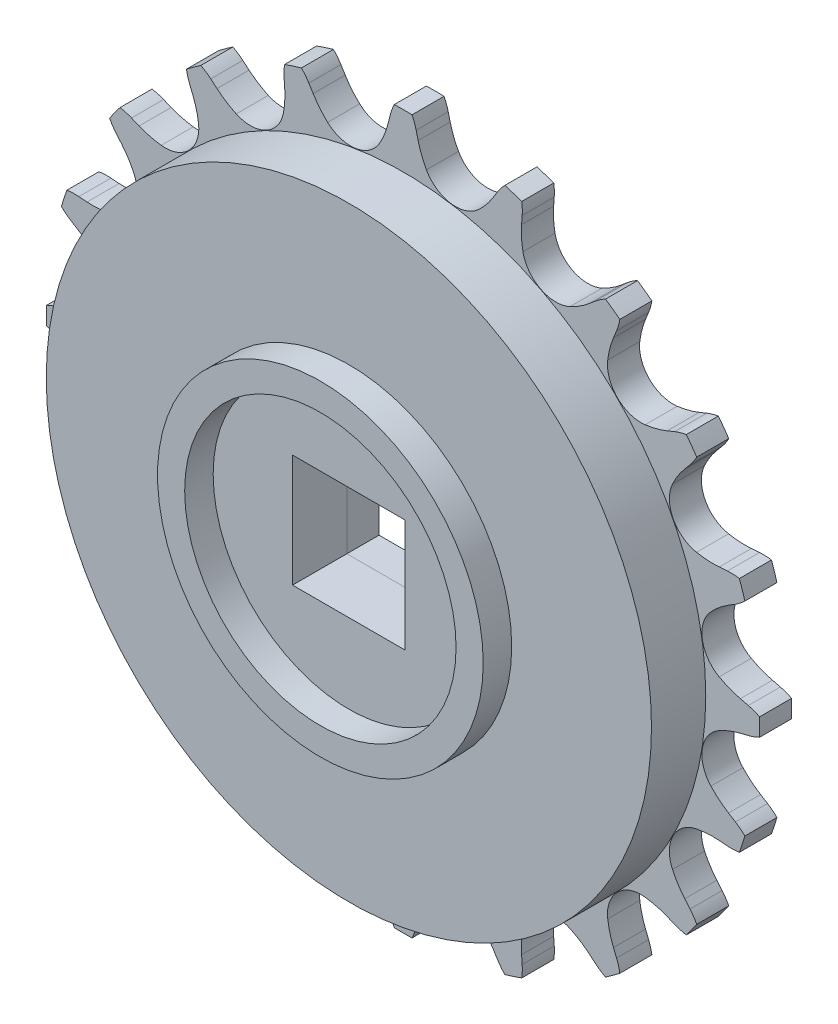
from build123d import *

# Parameters (mm, degrees)
SKETCH1_R           = 6.787119857
BOSS_EXTRUDE1_DEPTH = 2.3622
SKETCH2_R           = 18
BOSS_EXTRUDE2_DEPTH = 2.4
SKETCH6_R           = 22.300536673
BOSS_EXTRUDE3_DEPTH = 4
SKETCH8_W           = 8.3
SKETCH8_H           = 8.3
CUT_EXTRUDE1_DEPTH  = 38.706770721
SKETCH16_W          = 10
SKETCH16_H          = 8.25
BOSS_EXTRUDE6_DEPTH = 9.74160395
SKETCH17_R          = 12
SKETCH17_R_2        = 10
EXTRUDE_THIN1_DEPTH = 2.1
SKETCH18_R          = 53.221280842
CUT_EXTRUDE4_DEPTH  = 9


with BuildPart() as part:
    # Sketch1 → Boss-Extrude1 (new body)
    with BuildSketch(Plane.XY.offset(0.25)):
        with BuildLine():
            Line((-24.488227524, 6.948596415), (-23.976513369, 6.631320197))
            ThreePointArc((-23.976513369, 6.631320197), (-23.291994454, 6.141252786), (-22.678303214, 5.564958353))
            ThreePointArc((-22.678303214, 5.564958353), (-22.044379306, 3.491486679), (-23.288014754, 1.715391192))
            ThreePointArc((-23.288014754, 1.715391192), (-24.04975458, 1.356943638), (-24.852209913, 1.102389812))
            Line((-24.852209913, 1.102389812), (-25.436922738, 0.958770568))
            ThreePointArc((-25.436922738, 0.958770568), (-25.860833079, 0.829247508), (-26.267723996, 0.653418098))
            ThreePointArc((-26.267723996, 0.653418098), (-26.275849732, 0), (-26.267723996, -0.653418098))
            ThreePointArc((-26.267723996, -0.653418098), (-25.860833079, -0.829247508), (-25.436922738, -0.958770568))
            Line((-25.436922738, -0.958770568), (-24.852209913, -1.102389812))
            ThreePointArc((-24.852209913, -1.102389812), (-24.04975458, -1.356943638), (-23.288014754, -1.715391192))
            ThreePointArc((-23.288014754, -1.715391192), (-22.044379306, -3.491486679), (-22.678303214, -5.564958353))
            ThreePointArc((-22.678303214, -5.564958353), (-23.291994454, -6.141252786), (-23.976513369, -6.631320197))
            Line((-23.976513369, -6.631320197), (-24.488227524, -6.948596415))
            ThreePointArc((-24.488227524, -6.948596415), (-24.851365389, -7.202775664), (-25.184007371, -7.495735579))
            ThreePointArc((-25.184007371, -7.495735579), (-24.989818108, -8.119684109), (-24.780172778, -8.738610658))
            ThreePointArc((-24.780172778, -8.738610658), (-24.338862244, -8.780098157), (-23.895674726, -8.772286407))
            Line((-23.895674726, -8.772286407), (-23.295198996, -8.728190226))
            ThreePointArc((-23.295198996, -8.728190226), (-22.453357164, -8.722312965), (-21.618133153, -8.827826296))
            ThreePointArc((-21.618133153, -8.827826296), (-19.886521867, -10.132688993), (-19.848681346, -12.300571001))
            ThreePointArc((-19.848681346, -12.300571001), (-20.254251625, -13.0383006), (-20.753828642, -13.715910381))
            Line((-20.753828642, -13.715910381), (-21.14245398, -14.175786366))
            ThreePointArc((-21.14245398, -14.175786366), (-21.409272906, -14.529740969), (-21.635104637, -14.911154431))
            ThreePointArc((-21.635104637, -14.911154431), (-21.257608974, -15.444556964), (-20.866965595, -15.968407121))
            ThreePointArc((-20.866965595, -15.968407121), (-20.434433994, -15.871491623), (-20.01535158, -15.727109732))
            Line((-20.01535158, -15.727109732), (-19.457891694, -15.499614567))
            ThreePointArc((-19.457891694, -15.499614567), (-18.659068707, -15.233881527), (-17.832118057, -15.076132254))
            ThreePointArc((-17.832118057, -15.076132254), (-15.782033111, -15.782033111), (-15.076132254, -17.832118057))
            ThreePointArc((-15.076132254, -17.832118057), (-15.233881527, -18.659068707), (-15.499614567, -19.457891694))
            Line((-15.499614567, -19.457891694), (-15.727109732, -20.01535158))
            ThreePointArc((-15.727109732, -20.01535158), (-15.871491623, -20.434433994), (-15.968407121, -20.866965595))
            ThreePointArc((-15.968407121, -20.866965595), (-15.444556964, -21.257608974), (-14.911154431, -21.635104637))
            ThreePointArc((-14.911154431, -21.635104637), (-14.529740969, -21.409272906), (-14.175786366, -21.14245398))
            Line((-14.175786366, -21.14245398), (-13.715910381, -20.753828642))
            ThreePointArc((-13.715910381, -20.753828642), (-13.0383006, -20.254251625), (-12.300571001, -19.848681346))
            ThreePointArc((-12.300571001, -19.848681346), (-10.132688993, -19.886521867), (-8.827826296, -21.618133153))
            ThreePointArc((-8.827826296, -21.618133153), (-8.722312965, -22.453357164), (-8.728190226, -23.295198996))
            Line((-8.728190226, -23.295198996), (-8.772286407, -23.895674726))
            ThreePointArc((-8.772286407, -23.895674726), (-8.780098157, -24.338862244), (-8.738610658, -24.780172778))
            ThreePointArc((-8.738610658, -24.780172778), (-8.119684109, -24.989818108), (-7.495735579, -25.184007371))
            ThreePointArc((-7.495735579, -25.184007371), (-7.202775664, -24.851365389), (-6.948596415, -24.488227524))
            Line((-6.948596415, -24.488227524), (-6.631320197, -23.976513369))
            ThreePointArc((-6.631320197, -23.976513369), (-6.141252786, -23.291994454), (-5.564958353, -22.678303214))
            ThreePointArc((-5.564958353, -22.678303214), (-3.491486679, -22.044379306), (-1.715391192, -23.288014754))
            ThreePointArc((-1.715391192, -23.288014754), (-1.356943638, -24.04975458), (-1.102389812, -24.852209913))
            Line((-1.102389812, -24.852209913), (-0.958770568, -25.436922738))
            ThreePointArc((-0.958770568, -25.436922738), (-0.829247508, -25.860833079), (-0.653418098, -26.267723996))
            ThreePointArc((-0.653418098, -26.267723996), (0, -26.275849732), (0.653418098, -26.267723996))
            ThreePointArc((0.653418098, -26.267723996), (0.829247508, -25.860833079), (0.958770568, -25.436922738))
            Line((0.958770568, -25.436922738), (1.102389812, -24.852209913))
            ThreePointArc((1.102389812, -24.852209913), (1.356943638, -24.04975458), (1.715391192, -23.288014754))
            ThreePointArc((1.715391192, -23.288014754), (3.491486679, -22.044379306), (5.564958353, -22.678303214))
            ThreePointArc((5.564958353, -22.678303214), (6.141252786, -23.291994454), (6.631320197, -23.976513369))
            Line((6.631320197, -23.976513369), (6.948596415, -24.488227524))
            ThreePointArc((6.948596415, -24.488227524), (7.202775664, -24.851365389), (7.495735579, -25.184007371))
            ThreePointArc((7.495735579, -25.184007371), (8.119684109, -24.989818108), (8.738610658, -24.780172778))
            ThreePointArc((8.738610658, -24.780172778), (8.780098157, -24.338862244), (8.772286407, -23.895674726))
            Line((8.772286407, -23.895674726), (8.728190226, -23.295198996))
            ThreePointArc((8.728190226, -23.295198996), (8.722312965, -22.453357164), (8.827826296, -21.618133153))
            ThreePointArc((8.827826296, -21.618133153), (10.132688993, -19.886521867), (12.300571001, -19.848681346))
            ThreePointArc((12.300571001, -19.848681346), (13.0383006, -20.254251625), (13.715910381, -20.753828642))
            Line((13.715910381, -20.753828642), (14.175786366, -21.14245398))
            ThreePointArc((14.175786366, -21.14245398), (14.529740969, -21.409272906), (14.911154431, -21.635104637))
            ThreePointArc((14.911154431, -21.635104637), (15.444556964, -21.257608974), (15.968407121, -20.866965595))
            ThreePointArc((15.968407121, -20.866965595), (15.871491623, -20.434433994), (15.727109732, -20.01535158))
            Line((15.727109732, -20.01535158), (15.499614567, -19.457891694))
            ThreePointArc((15.499614567, -19.457891694), (15.233881527, -18.659068707), (15.076132254, -17.832118057))
            ThreePointArc((15.076132254, -17.832118057), (15.782033111, -15.782033111), (17.832118057, -15.076132254))
            ThreePointArc((17.832118057, -15.076132254), (18.659068707, -15.233881527), (19.457891694, -15.499614567))
            Line((19.457891694, -15.499614567), (20.01535158, -15.727109732))
            ThreePointArc((20.01535158, -15.727109732), (20.434433994, -15.871491623), (20.866965595, -15.968407121))
            ThreePointArc((20.866965595, -15.968407121), (21.257608974, -15.444556964), (21.635104637, -14.911154431))
            ThreePointArc((21.635104637, -14.911154431), (21.409272906, -14.529740969), (21.14245398, -14.175786366))
            Line((21.14245398, -14.175786366), (20.753828642, -13.715910381))
            ThreePointArc((20.753828642, -13.715910381), (20.254251625, -13.0383006), (19.848681346, -12.300571001))
            ThreePointArc((19.848681346, -12.300571001), (19.886521867, -10.132688993), (21.618133153, -8.827826296))
            ThreePointArc((21.618133153, -8.827826296), (22.453357164, -8.722312965), (23.295198996, -8.728190226))
            Line((23.295198996, -8.728190226), (23.895674726, -8.772286407))
            ThreePointArc((23.895674726, -8.772286407), (24.338862244, -8.780098157), (24.780172778, -8.738610658))
            ThreePointArc((24.780172778, -8.738610658), (24.989818108, -8.119684109), (25.184007371, -7.495735579))
            ThreePointArc((25.184007371, -7.495735579), (24.851365389, -7.202775664), (24.488227524, -6.948596415))
            Line((24.488227524, -6.948596415), (23.976513369, -6.631320197))
            ThreePointArc((23.976513369, -6.631320197), (23.291994454, -6.141252786), (22.678303214, -5.564958353))
            ThreePointArc((22.678303214, -5.564958353), (22.044379306, -3.491486679), (23.288014754, -1.715391192))
            ThreePointArc((23.288014754, -1.715391192), (24.04975458, -1.356943638), (24.852209913, -1.102389812))
            Line((24.852209913, -1.102389812), (25.436922738, -0.958770568))
            ThreePointArc((25.436922738, -0.958770568), (25.860833079, -0.829247508), (26.267723996, -0.653418098))
            ThreePointArc((26.267723996, -0.653418098), (26.275849732, 0), (26.267723996, 0.653418098))
            ThreePointArc((26.267723996, 0.653418098), (25.860833079, 0.829247508), (25.436922738, 0.958770568))
            Line((25.436922738, 0.958770568), (24.852209913, 1.102389812))
            ThreePointArc((24.852209913, 1.102389812), (24.04975458, 1.356943638), (23.288014754, 1.715391192))
            ThreePointArc((23.288014754, 1.715391192), (22.044379306, 3.491486679), (22.678303214, 5.564958353))
            ThreePointArc((22.678303214, 5.564958353), (23.291994454, 6.141252786), (23.976513369, 6.631320197))
            Line((23.976513369, 6.631320197), (24.488227524, 6.948596415))
            ThreePointArc((24.488227524, 6.948596415), (24.851365389, 7.202775664), (25.184007371, 7.495735579))
            ThreePointArc((25.184007371, 7.495735579), (24.989818108, 8.119684109), (24.780172778, 8.738610658))
            ThreePointArc((24.780172778, 8.738610658), (24.338862244, 8.780098157), (23.895674726, 8.772286407))
            Line((23.895674726, 8.772286407), (23.295198996, 8.728190226))
            ThreePointArc((23.295198996, 8.728190226), (22.453357164, 8.722312965), (21.618133153, 8.827826296))
            ThreePointArc((21.618133153, 8.827826296), (19.886521867, 10.132688993), (19.848681346, 12.300571001))
            ThreePointArc((19.848681346, 12.300571001), (20.254251625, 13.0383006), (20.753828642, 13.715910381))
            Line((20.753828642, 13.715910381), (21.14245398, 14.175786366))
            ThreePointArc((21.14245398, 14.175786366), (21.409272906, 14.529740969), (21.635104637, 14.911154431))
            ThreePointArc((21.635104637, 14.911154431), (21.257608974, 15.444556964), (20.866965595, 15.968407121))
            ThreePointArc((20.866965595, 15.968407121), (20.434433994, 15.871491623), (20.01535158, 15.727109732))
            Line((20.01535158, 15.727109732), (19.457891694, 15.499614567))
            ThreePointArc((19.457891694, 15.499614567), (18.659068707, 15.233881527), (17.832118057, 15.076132254))
            ThreePointArc((17.832118057, 15.076132254), (15.782033111, 15.782033111), (15.076132254, 17.832118057))
            ThreePointArc((15.076132254, 17.832118057), (15.233881527, 18.659068707), (15.499614567, 19.457891694))
            Line((15.499614567, 19.457891694), (15.727109732, 20.01535158))
            ThreePointArc((15.727109732, 20.01535158), (15.871491623, 20.434433994), (15.968407121, 20.866965595))
            ThreePointArc((15.968407121, 20.866965595), (15.444556964, 21.257608974), (14.911154431, 21.635104637))
            ThreePointArc((14.911154431, 21.635104637), (14.529740969, 21.409272906), (14.175786366, 21.14245398))
            Line((14.175786366, 21.14245398), (13.715910381, 20.753828642))
            ThreePointArc((13.715910381, 20.753828642), (13.0383006, 20.254251625), (12.300571001, 19.848681346))
            ThreePointArc((12.300571001, 19.848681346), (10.132688993, 19.886521867), (8.827826296, 21.618133153))
            ThreePointArc((8.827826296, 21.618133153), (8.722312965, 22.453357164), (8.728190226, 23.295198996))
            Line((8.728190226, 23.295198996), (8.772286407, 23.895674726))
            ThreePointArc((8.772286407, 23.895674726), (8.780098157, 24.338862244), (8.738610658, 24.780172778))
            ThreePointArc((8.738610658, 24.780172778), (8.119684109, 24.989818108), (7.495735579, 25.184007371))
            ThreePointArc((7.495735579, 25.184007371), (7.202775664, 24.851365389), (6.948596415, 24.488227524))
            Line((6.948596415, 24.488227524), (6.631320197, 23.976513369))
            ThreePointArc((6.631320197, 23.976513369), (6.141252786, 23.291994454), (5.564958353, 22.678303214))
            ThreePointArc((5.564958353, 22.678303214), (3.491486679, 22.044379306), (1.715391192, 23.288014754))
            ThreePointArc((1.715391192, 23.288014754), (1.356943638, 24.04975458), (1.102389812, 24.852209913))
            Line((1.102389812, 24.852209913), (0.958770568, 25.436922738))
            ThreePointArc((0.958770568, 25.436922738), (0.829247508, 25.860833079), (0.653418098, 26.267723996))
            ThreePointArc((0.653418098, 26.267723996), (0, 26.275849732), (-0.653418098, 26.267723996))
            ThreePointArc((-0.653418098, 26.267723996), (-0.829247508, 25.860833079), (-0.958770568, 25.436922738))
            Line((-0.958770568, 25.436922738), (-1.102389812, 24.852209913))
            ThreePointArc((-1.102389812, 24.852209913), (-1.356943638, 24.04975458), (-1.715391192, 23.288014754))
            ThreePointArc((-1.715391192, 23.288014754), (-3.491486679, 22.044379306), (-5.564958353, 22.678303214))
            ThreePointArc((-5.564958353, 22.678303214), (-6.141252786, 23.291994454), (-6.631320197, 23.976513369))
            Line((-6.631320197, 23.976513369), (-6.948596415, 24.488227524))
            ThreePointArc((-6.948596415, 24.488227524), (-7.202775664, 24.851365389), (-7.495735579, 25.184007371))
            ThreePointArc((-7.495735579, 25.184007371), (-8.119684109, 24.989818108), (-8.738610658, 24.780172778))
            ThreePointArc((-8.738610658, 24.780172778), (-8.780098157, 24.338862244), (-8.772286407, 23.895674726))
            Line((-8.772286407, 23.895674726), (-8.728190226, 23.295198996))
            ThreePointArc((-8.728190226, 23.295198996), (-8.722312965, 22.453357164), (-8.827826296, 21.618133153))
            ThreePointArc((-8.827826296, 21.618133153), (-10.132688993, 19.886521867), (-12.300571001, 19.848681346))
            ThreePointArc((-12.300571001, 19.848681346), (-13.0383006, 20.254251625), (-13.715910381, 20.753828642))
            Line((-13.715910381, 20.753828642), (-14.175786366, 21.14245398))
            ThreePointArc((-14.175786366, 21.14245398), (-14.529740969, 21.409272906), (-14.911154431, 21.635104637))
            ThreePointArc((-14.911154431, 21.635104637), (-15.444556964, 21.257608974), (-15.968407121, 20.866965595))
            ThreePointArc((-15.968407121, 20.866965595), (-15.871491623, 20.434433994), (-15.727109732, 20.01535158))
            Line((-15.727109732, 20.01535158), (-15.499614567, 19.457891694))
            ThreePointArc((-15.499614567, 19.457891694), (-15.233881527, 18.659068707), (-15.076132254, 17.832118057))
            ThreePointArc((-15.076132254, 17.832118057), (-15.782033111, 15.782033111), (-17.832118057, 15.076132254))
            ThreePointArc((-17.832118057, 15.076132254), (-18.659068707, 15.233881527), (-19.457891694, 15.499614567))
            Line((-19.457891694, 15.499614567), (-20.01535158, 15.727109732))
            ThreePointArc((-20.01535158, 15.727109732), (-20.434433994, 15.871491623), (-20.866965595, 15.968407121))
            ThreePointArc((-20.866965595, 15.968407121), (-21.257608974, 15.444556964), (-21.635104637, 14.911154431))
            ThreePointArc((-21.635104637, 14.911154431), (-21.409272906, 14.529740969), (-21.14245398, 14.175786366))
            Line((-21.14245398, 14.175786366), (-20.753828642, 13.715910381))
            ThreePointArc((-20.753828642, 13.715910381), (-20.254251625, 13.0383006), (-19.848681346, 12.300571001))
            ThreePointArc((-19.848681346, 12.300571001), (-19.886521867, 10.132688993), (-21.618133153, 8.827826296))
            ThreePointArc((-21.618133153, 8.827826296), (-22.453357164, 8.722312965), (-23.295198996, 8.728190226))
            Line((-23.295198996, 8.728190226), (-23.895674726, 8.772286407))
            ThreePointArc((-23.895674726, 8.772286407), (-24.338862244, 8.780098157), (-24.780172778, 8.738610658))
            ThreePointArc((-24.780172778, 8.738610658), (-24.989818108, 8.119684109), (-25.184007371, 7.495735579))
            ThreePointArc((-25.184007371, 7.495735579), (-24.851365389, 7.202775664), (-24.488227524, 6.948596415))
        make_face()
        with Locations(Location((0, 0, 0), (0, 0, 180))):
            Circle(SKETCH1_R, mode=Mode.SUBTRACT)
        with BuildLine():
            Line((6.385503129, 9.127913687), (6.856026394, 9.598436951))
            ThreePointArc((6.856026394, 9.598436951), (9.598436951, 9.598436951), (9.598436951, 6.856026394))
            Line((9.598436951, 6.856026394), (9.127913687, 6.385503129))
            ThreePointArc((9.127913687, 6.385503129), (6.385503129, 6.385503129), (6.385503129, 9.127913687))
        make_face(mode=Mode.SUBTRACT)
        with BuildLine():
            Line((9.127913687, -6.385503129), (9.598436951, -6.856026394))
            ThreePointArc((9.598436951, -6.856026394), (9.598436951, -9.598436951), (6.856026394, -9.598436951))
            Line((6.856026394, -9.598436951), (6.385503129, -9.127913687))
            ThreePointArc((6.385503129, -9.127913687), (6.385503129, -6.385503129), (9.127913687, -6.385503129))
        make_face(mode=Mode.SUBTRACT)
        with BuildLine():
            Line((-6.385503129, -9.127913687), (-6.856026394, -9.598436951))
            ThreePointArc((-6.856026394, -9.598436951), (-9.598436951, -9.598436951), (-9.598436951, -6.856026394))
            Line((-9.598436951, -6.856026394), (-9.127913687, -6.385503129))
            ThreePointArc((-9.127913687, -6.385503129), (-6.385503129, -6.385503129), (-6.385503129, -9.127913687))
        make_face(mode=Mode.SUBTRACT)
        with BuildLine():
            Line((1.939177102, 15.513416816), (1.939177102, 10.96964223))
            ThreePointArc((1.939177102, 10.96964223), (0, 9.030465128), (-1.939177102, 10.96964223))
            Line((-1.939177102, 10.96964223), (-1.939177102, 15.513416816))
            ThreePointArc((-1.939177102, 15.513416816), (0, 17.452593918), (1.939177102, 15.513416816))
        make_face(mode=Mode.SUBTRACT)
        with BuildLine():
            Line((-1.939177102, -15.513416816), (-1.939177102, -10.96964223))
            ThreePointArc((-1.939177102, -10.96964223), (0, -9.030465128), (1.939177102, -10.96964223))
            Line((1.939177102, -10.96964223), (1.939177102, -15.513416816))
            ThreePointArc((1.939177102, -15.513416816), (0, -17.452593918), (-1.939177102, -15.513416816))
        make_face(mode=Mode.SUBTRACT)
        with BuildLine():
            Line((15.513416816, -1.939177102), (10.96964223, -1.939177102))
            ThreePointArc((10.96964223, -1.939177102), (9.030465128, 0), (10.96964223, 1.939177102))
            Line((10.96964223, 1.939177102), (15.513416816, 1.939177102))
            ThreePointArc((15.513416816, 1.939177102), (17.452593918, 0), (15.513416816, -1.939177102))
        make_face(mode=Mode.SUBTRACT)
        with BuildLine():
            Line((-15.513416816, 1.939177102), (-10.96964223, 1.939177102))
            ThreePointArc((-10.96964223, 1.939177102), (-9.030465128, 0), (-10.96964223, -1.939177102))
            Line((-10.96964223, -1.939177102), (-15.513416816, -1.939177102))
            ThreePointArc((-15.513416816, -1.939177102), (-17.452593918, 0), (-15.513416816, 1.939177102))
        make_face(mode=Mode.SUBTRACT)
        with BuildLine():
            Line((-6.856026394, 9.598436951), (-6.385503129, 9.127913687))
            ThreePointArc((-6.385503129, 9.127913687), (-6.385503129, 6.385503129), (-9.127913687, 6.385503129))
            Line((-9.127913687, 6.385503129), (-9.598436951, 6.856026394))
            ThreePointArc((-9.598436951, 6.856026394), (-9.598436951, 9.598436951), (-6.856026394, 9.598436951))
        make_face(mode=Mode.SUBTRACT)
    extrude(amount=-BOSS_EXTRUDE1_DEPTH)



with BuildPart() as body_2:
    # Sketch2 → Boss-Extrude2 (new body)
    with BuildSketch(Plane.XY.offset(0.25)):
        Circle(SKETCH2_R)
    extrude(amount=-BOSS_EXTRUDE2_DEPTH)


with BuildPart() as body_3:
    # Sketch6 → Boss-Extrude3 (new body)
    with BuildSketch(Plane.XY.offset(0.25)):
        Circle(SKETCH6_R)
    extrude(amount=BOSS_EXTRUDE3_DEPTH)


with BuildPart() as cut_extrude1_tool:
    # Sketch8 → Cut-Extrude1 (new, through all)
    with BuildSketch(Plane.XY.offset(4.25)):
        Rectangle(SKETCH8_W, SKETCH8_H)
    extrude(amount=-CUT_EXTRUDE1_DEPTH)


with BuildPart() as body_2_1:
    add(body_2.part)

    # Cut-Extrude1: cut by cut_extrude1_tool
    add(cut_extrude1_tool.part, mode=Mode.SUBTRACT)


with BuildPart() as body_3_1:
    add(body_3.part)

    # Cut-Extrude1: cut by cut_extrude1_tool
    add(cut_extrude1_tool.part, mode=Mode.SUBTRACT)

    # Sketch17 → Extrude-Thin1 (add)
    with BuildSketch(Plane.XY.offset(4.25)):
        Circle(SKETCH17_R)
        Circle(SKETCH17_R_2, mode=Mode.SUBTRACT)
    extrude(amount=EXTRUDE_THIN1_DEPTH)


with BuildPart() as part_1:
    add(part.part)

    add(body_2_1.part)  # Boss-Extrude6 merges body 2
    # Sketch16 → Boss-Extrude6 (add)
    with BuildSketch(Plane(origin=(-4.15, 0, 0), x_dir=(0, 0, -1), z_dir=(1, 0, 0))):
        with Locations((6.122710298, -0.025)):
            Rectangle(SKETCH16_W, SKETCH16_H)
    boss_extrude6 = extrude(amount=-BOSS_EXTRUDE6_DEPTH)

    # Mirror1: Boss-Extrude6 across plane
    add(boss_extrude6.mirror(Plane(origin=(-0.05, 0, 0), x_dir=(0, 0, 1), z_dir=(1, 0, 0))))

    # Sketch18 → Cut-Extrude4 (cut)
    with BuildSketch(Plane(origin=(0, 0, -11.122710298), x_dir=(-1, 0, 0), z_dir=(0, 0, -1))):
        Circle(SKETCH18_R)
    extrude(amount=-CUT_EXTRUDE4_DEPTH, mode=Mode.SUBTRACT)


solid = Compound([body_3_1.part, part_1.part])
